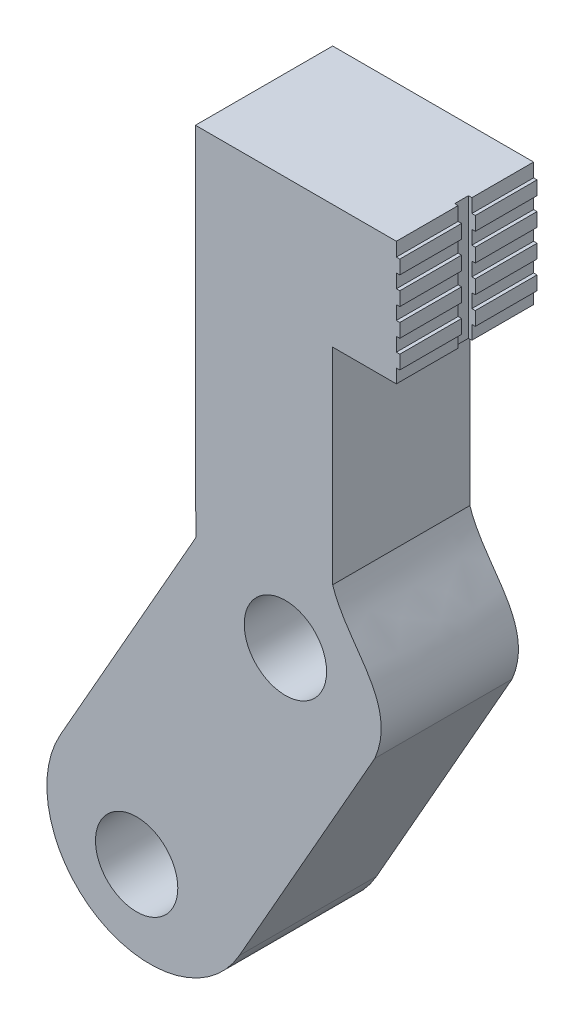
from build123d import *

# Parameters (mm, degrees)
BOSS_EXTRUDE1_DEPTH = 10
SKETCH2_W           = 1
SKETCH2_H           = 9
CUT_EXTRUDE1_DEPTH  = 0.5
SKETCH4_W           = 4.5
SKETCH4_H           = 1
CUT_EXTRUDE4_DEPTH  = 0.25
SKETCH5_W           = 4.5
SKETCH5_H           = 1
CUT_EXTRUDE5_DEPTH  = 0.25
SKETCH6_R           = 3
CUT_EXTRUDE6_DEPTH  = 34.739405243


with BuildPart() as part:
    # Sketch1 → Boss-Extrude1 (new body)
    with BuildSketch(Plane.XY):
        with BuildLine():
            Line((0, 0), (-9.88076328, -17.388804358))
            ThreePointArc((-9.88076328, -17.388804358), (-7.065247876, -27.614892222), (3.160839988, -24.799376818))
            Line((3.160839988, -24.799376818), (13.041603269, -7.41057246))
            add(Edge.make_bspline(
                [(13.041603269, -7.41057246), (14.806349741, -3.203268527), (10.991774611, -1.261774485), (9.965646647, 2)],
                knots=[0, 0, 0, 0, 1, 1, 1, 1], degree=3))
            Line((9.965646647, 2), (9.965646647, 17))
            Line((9.965646647, 17), (14.856831388, 17))
            Line((14.856831388, 17), (14.856831388, 26))
            Line((14.856831388, 26), (-0.034353353, 26))
            Line((-0.034353353, 26), (-0.034353353, 15))
            Line((-0.034353353, 15), (-0.034353353, 5))
            Line((-0.034353353, 5), (0, 0))
        make_face()
    extrude(amount=BOSS_EXTRUDE1_DEPTH)

    # Sketch2 → Cut-Extrude1 (cut)
    with BuildSketch(Plane(origin=(14.856831388, 0, 0), x_dir=(0, 0, -1), z_dir=(1, 0, 0))):
        with Locations((-5, 21.5)):
            Rectangle(SKETCH2_W, SKETCH2_H)
    extrude(amount=-CUT_EXTRUDE1_DEPTH, mode=Mode.SUBTRACT)

    # Sketch4 → Cut-Extrude4 (cut)
    with BuildSketch(Plane(origin=(14.856831388, 0, 0), x_dir=(0, 0, -1), z_dir=(1, 0, 0))):
        with Locations((-7.75, 17.5)):
            Rectangle(SKETCH4_W, SKETCH4_H)
        with Locations((-7.75, 19.5)):
            Rectangle(SKETCH4_W, SKETCH4_H)
        with Locations((-7.75, 21.5)):
            Rectangle(SKETCH4_W, SKETCH4_H)
        with Locations((-7.75, 23.5)):
            Rectangle(SKETCH4_W, SKETCH4_H)
        with Locations((-7.75, 25.5)):
            Rectangle(SKETCH4_W, SKETCH4_H)
    extrude(amount=-CUT_EXTRUDE4_DEPTH, mode=Mode.SUBTRACT)

    # Sketch5 → Cut-Extrude5 (cut)
    with BuildSketch(Plane(origin=(14.856831388, 0, 0), x_dir=(0, 0, -1), z_dir=(1, 0, 0))):
        with Locations((-2.25, 17.5)):
            Rectangle(SKETCH5_W, SKETCH5_H)
        with Locations((-2.25, 19.5)):
            Rectangle(SKETCH5_W, SKETCH5_H)
        with Locations((-2.25, 21.5)):
            Rectangle(SKETCH5_W, SKETCH5_H)
        with Locations((-2.25, 23.5)):
            Rectangle(SKETCH5_W, SKETCH5_H)
        with Locations((-2.25, 25.5)):
            Rectangle(SKETCH5_W, SKETCH5_H)
    extrude(amount=-CUT_EXTRUDE5_DEPTH, mode=Mode.SUBTRACT)

    # Sketch6 → Cut-Extrude6 (cut, through all)
    with BuildSketch(Plane.XY.offset(10)):
        with Locations((-4.31940135, -22.782574446)):
            Circle(SKETCH6_R)
        with Locations((6.520801634, -3.70528623)):
            Circle(SKETCH6_R)
    extrude(amount=-CUT_EXTRUDE6_DEPTH, mode=Mode.SUBTRACT)


solid = part.part
